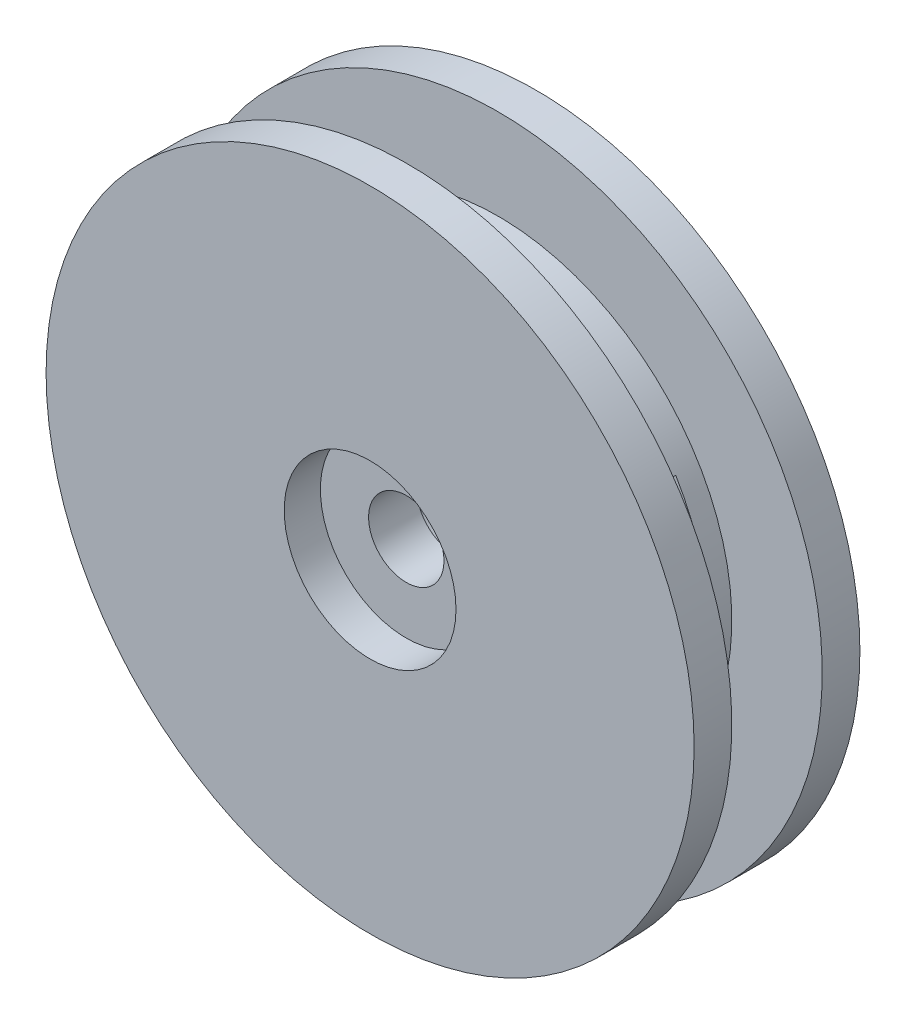
from build123d import *

# Parameters (mm, degrees)
CROQUIS1_R                 = 10.75
SALIENTE_EXTRUIR1_DEPTH    = 5.5
CROQUIS3_R                 = 2.85
CORTAR_EXTRUIR1_DEPTH      = 1.2
CROQUIS4_R                 = 1.25
CORTAR_EXTRUIR2_DEPTH      = 17.167096214
CROQUIS5_R                 = 2.32
CORTAR_EXTRUIR3_DEPTH      = 2.7
CORTAR_EXTRUIR4_DEPTH      = 17.167096214
CORTAR_EXTRUIR4_DEPTH_BACK = 17.167096214
CROQUIS6_W                 = 1.5
CROQUIS6_H                 = 1.5


with BuildPart() as part:
    # Croquis1 → Saliente-Extruir1 (new body)
    with BuildSketch(Plane.XY):
        Circle(CROQUIS1_R)
    extrude(amount=SALIENTE_EXTRUIR1_DEPTH)

    # Croquis2 → Cortar-Revolución1 (revolve, cut)
    with BuildSketch(Plane(origin=(0, 0, 0), x_dir=(0, 0, -1), z_dir=(1, 0, 0)), mode=Mode.PRIVATE) as cortar_revoluci_n1_sk:
        Polygon((-5.5, 10.75), (-4.25, 10.75), (-4.25, 7.75), (-1.25, 7.75), (-1.25, 10.75), (0, 10.75), (0, 13.530555933), (-5.5, 13.530555933), align=None)
    revolve(cortar_revoluci_n1_sk.sketch.rotate(Axis((0, 0, 0), (0, 0, 1)), 90), axis=Axis((0, 0, 0), (0, 0, 1)), mode=Mode.SUBTRACT)

    # Croquis3 → Cortar-Extruir1 (cut)
    with BuildSketch(Plane.XY.offset(5.5)):
        Circle(CROQUIS3_R)
    extrude(amount=-CORTAR_EXTRUIR1_DEPTH, mode=Mode.SUBTRACT)

    # Croquis4 → Cortar-Extruir2 (cut, through all)
    with BuildSketch(Plane.XY.offset(5.5)):
        Circle(CROQUIS4_R)
    extrude(amount=-CORTAR_EXTRUIR2_DEPTH, mode=Mode.SUBTRACT)

    # Croquis5 → Cortar-Extruir3 (cut)
    with BuildSketch(Plane(origin=(0, 0, 0), x_dir=(-1, 0, 0), z_dir=(0, 0, -1))):
        Circle(CROQUIS5_R)
    extrude(amount=-CORTAR_EXTRUIR3_DEPTH, mode=Mode.SUBTRACT)

    # Croquis6 → Cortar-Extruir4 (cut, two sides: drawn at the far end of the back side and taken through both)
    with BuildSketch(Plane(origin=(0, 0, 0), x_dir=(0, 0, -1), z_dir=(1, 0, 0)).offset(-CORTAR_EXTRUIR4_DEPTH_BACK)):
        with Locations((-2.75, 3.25)):
            Rectangle(CROQUIS6_W, CROQUIS6_H)
    extrude(amount=CORTAR_EXTRUIR4_DEPTH + CORTAR_EXTRUIR4_DEPTH_BACK, mode=Mode.SUBTRACT)


solid = part.part
